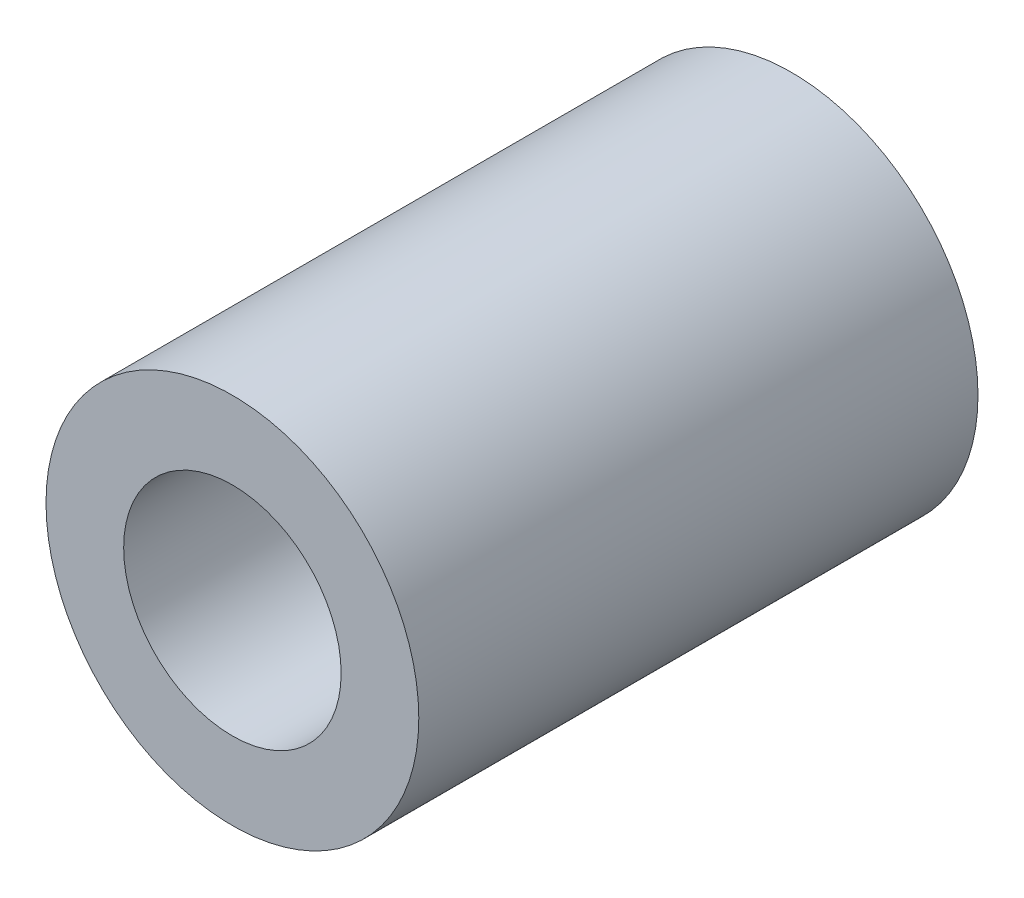
from build123d import *

# Parameters (mm, degrees)
SKETCH1_W = 0.833333333
SKETCH1_H = 6


with BuildPart() as part:
    # Sketch1 → Revolve1 (revolve)
    with BuildSketch(Plane(origin=(0, 0.806470296, 0), x_dir=(1, 0, 0), z_dir=(0, 1, 0))):
        with Locations((2.721142694, -7)):
            Rectangle(SKETCH1_W, SKETCH1_H)
    revolve(axis=Axis((1.13780936, 0.806470296, 0), (0, 0, 1)))


solid = part.part
